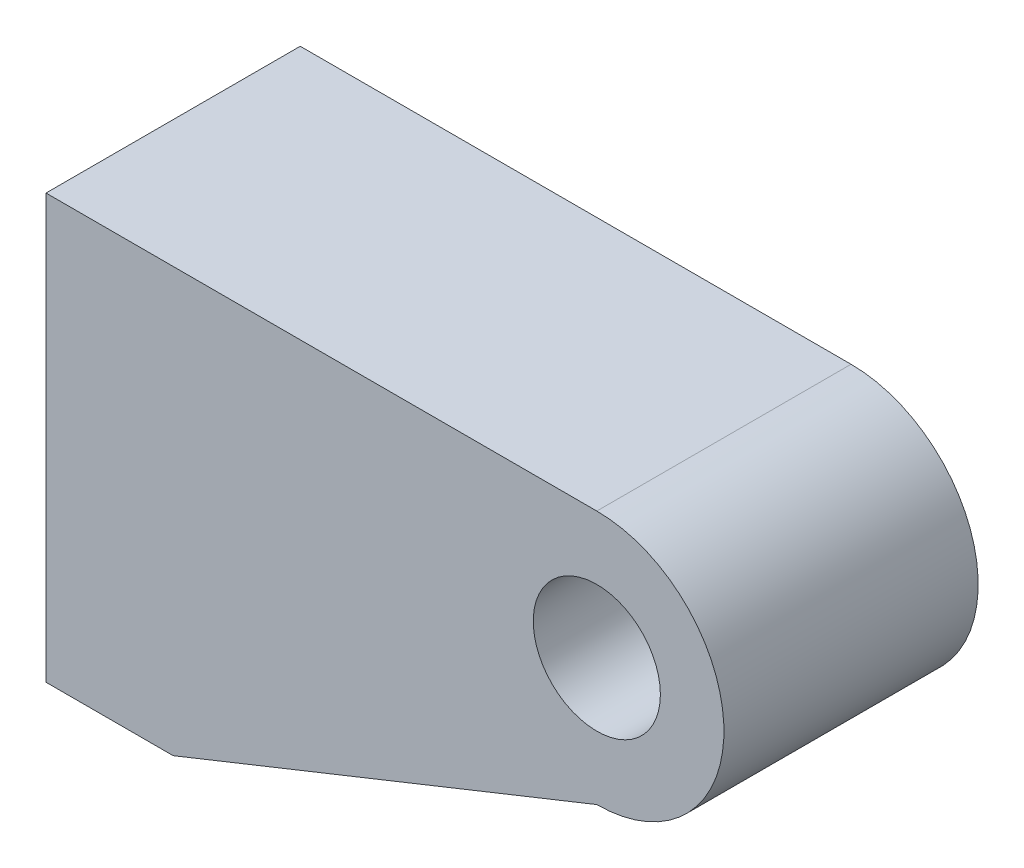
from build123d import *

# Parameters (mm, degrees)
SKETCH1_R           = 1.5
BOSS_EXTRUDE1_DEPTH = 6


with BuildPart() as part:
    # Sketch1 → Boss-Extrude1 (new body)
    with BuildSketch(Plane.XY):
        with BuildLine():
            Line((0, 0), (13, 0))
            ThreePointArc((13, 0), (16, -3), (13, -6))
            Line((13, -6), (3, -10))
            Line((3, -10), (0, -10))
            Line((0, -10), (0, 0))
        make_face()
        with Locations((13, -3)):
            Circle(SKETCH1_R, mode=Mode.SUBTRACT)
    extrude(amount=BOSS_EXTRUDE1_DEPTH)


solid = part.part
